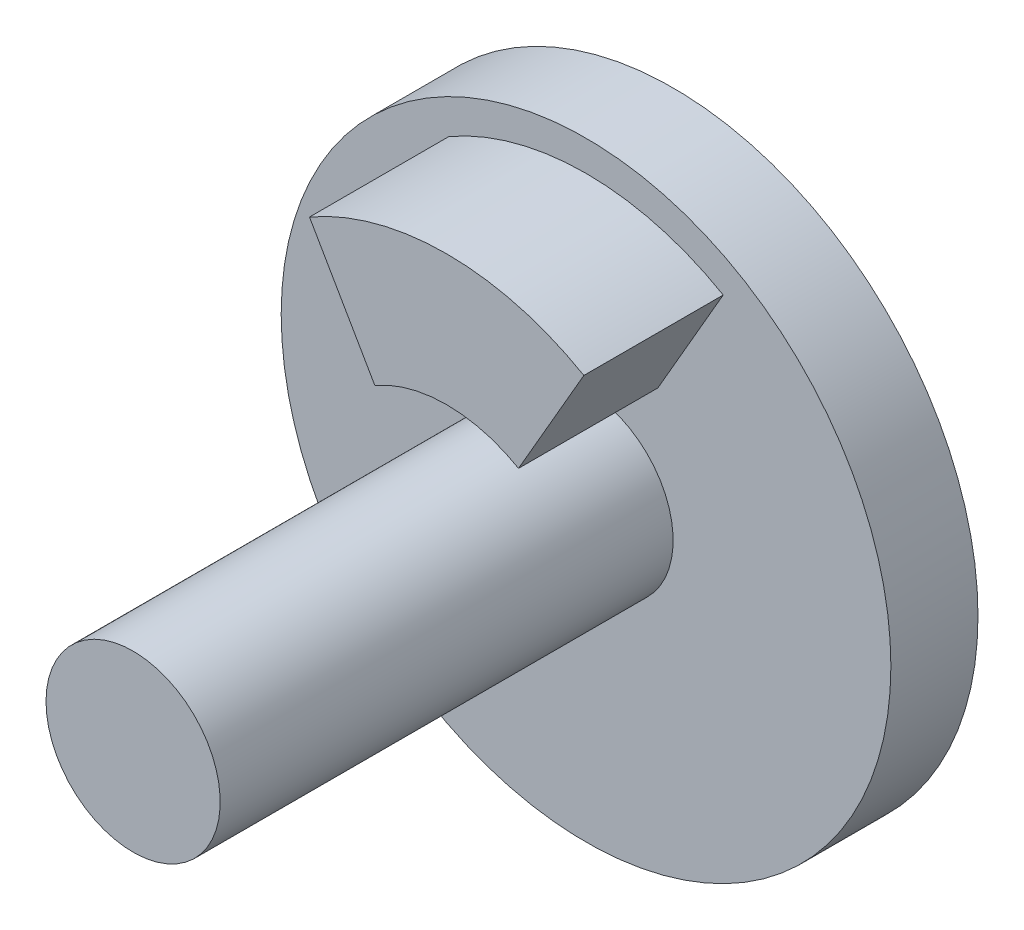
from build123d import *

# Parameters (mm, degrees)
SKETCH1_R           = 17.5
BOSS_EXTRUDE1_DEPTH = 2.5
BOSS_EXTRUDE2_DEPTH = 8
SKETCH3_R           = 5
BOSS_EXTRUDE3_DEPTH = 26
CUT_EXTRUDE1_DEPTH  = 10


with BuildPart() as part:
    # Sketch1 → Boss-Extrude1 (new, symmetric)
    with BuildSketch(Plane.XY):
        Circle(SKETCH1_R)
    extrude(amount=BOSS_EXTRUDE1_DEPTH, both=True)

    # Sketch2 → Boss-Extrude2 (add)
    with BuildSketch(Plane.XY.offset(2.5)):
        with BuildLine():
            Line((7.875, 13.63990011), (4.125, 7.144709581))
            ThreePointArc((4.125, 7.144709581), (0, 8.25), (-4.125, 7.144709581))
            Line((-4.125, 7.144709581), (-7.875, 13.63990011))
            ThreePointArc((-7.875, 13.63990011), (0, 15.75), (7.875, 13.63990011))
        make_face()
    extrude(amount=BOSS_EXTRUDE2_DEPTH)

    # Sketch3 → Boss-Extrude3 (add)
    with BuildSketch(Plane.XY.offset(2.5)):
        with Locations(Location((0, 0, 0), (0, 0, 180))):
            Circle(SKETCH3_R)
    extrude(amount=BOSS_EXTRUDE3_DEPTH)

    # Sketch4 → Cut-Extrude1 (cut)
    with BuildSketch(Plane(origin=(0, 0, -2.5), x_dir=(-1, 0, 0), z_dir=(0, 0, -1))):
        with BuildLine():
            Line((-2.236067977, 2), (2.236067977, 2))
            ThreePointArc((2.236067977, 2), (0, -3), (-2.236067977, 2))
        make_face()
    extrude(amount=-CUT_EXTRUDE1_DEPTH, mode=Mode.SUBTRACT)


solid = part.part
